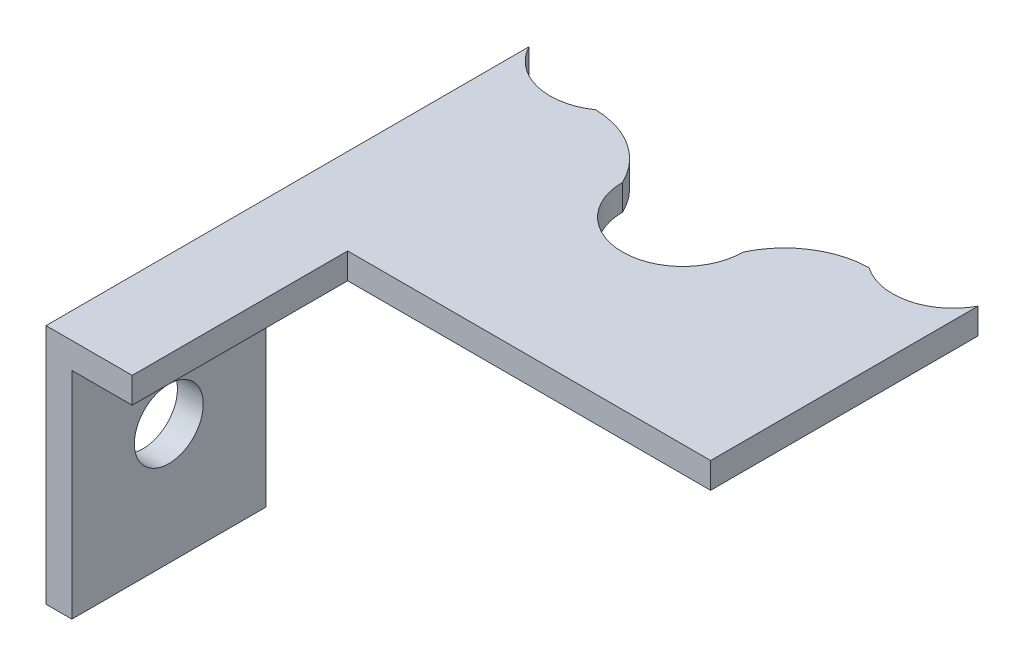
from build123d import *

# Parameters (mm, degrees)
BOSS_EXTRUDE1_DEPTH = 3
SKETCH3_W           = 10
SKETCH3_H           = 3
BOSS_EXTRUDE2_DEPTH = 25
SKETCH4_W           = 3
SKETCH4_H           = 22.5
BOSS_EXTRUDE3_DEPTH = 25
SKETCH5_R           = 4
CUT_EXTRUDE1_DEPTH  = 3


with BuildPart() as part:
    # Sketch2 → Boss-Extrude1 (new body)
    with BuildSketch(Plane(origin=(0, 0, 0), x_dir=(1, 0, 0), z_dir=(0, 1, 0))):
        with BuildLine():
            Line((26.055569119, 8.188046441), (26.055569119, -22.834953559))
            Line((26.055569119, -22.834953559), (-26.055569119, -22.834953559))
            Line((-26.055569119, -22.834953559), (-26.055569119, 8.188046441))
            ThreePointArc((-26.055569119, 8.188046441), (-21.514872246, 4.669726518), (-15.870079226, 5.73406431))
            ThreePointArc((-15.870079226, 5.73406431), (-10.616247764, 4.133629141), (-7, 0))
            ThreePointArc((-7, 0), (0, -7), (7, 0))
            ThreePointArc((7, 0), (10.616247764, 4.133629141), (15.870079226, 5.73406431))
            ThreePointArc((15.870079226, 5.73406431), (21.514872246, 4.669726518), (26.055569119, 8.188046441))
        make_face()
    extrude(amount=BOSS_EXTRUDE1_DEPTH)

    # Sketch3 → Boss-Extrude2 (add)
    with BuildSketch(Plane.XY.offset(22.834953559)):
        with Locations((-21.055569119, 1.5)):
            Rectangle(SKETCH3_W, SKETCH3_H)
    extrude(amount=BOSS_EXTRUDE2_DEPTH)

    # Sketch4 → Boss-Extrude3 (add)
    with BuildSketch(Plane.XZ):
        with Locations((-24.555569119, 36.584953559)):
            Rectangle(SKETCH4_W, SKETCH4_H)
    extrude(amount=BOSS_EXTRUDE3_DEPTH)

    # Sketch5 → Cut-Extrude1 (cut)
    with BuildSketch(Plane.ZY.offset(26.055569119)):
        with Locations((36.584953559, -11)):
            Circle(SKETCH5_R)
    extrude(amount=-CUT_EXTRUDE1_DEPTH, mode=Mode.SUBTRACT)


solid = part.part
